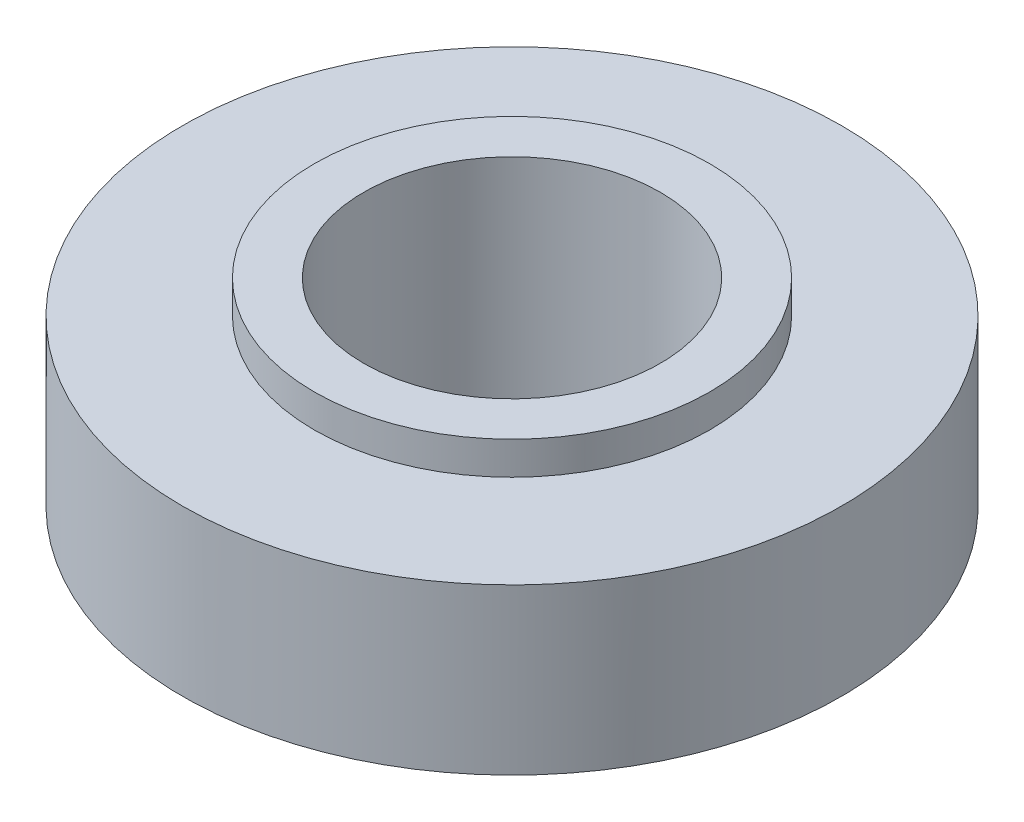
from build123d import *

# Parameters (mm, degrees)
SKETCH1_R           = 10
SKETCH1_R_2         = 4.5
BOSS_EXTRUDE1_DEPTH = 3.5
SKETCH2_R           = 13
SKETCH2_R_2         = 6
CUT_EXTRUDE1_DEPTH  = 1


with BuildPart() as part:
    # Sketch1 → Boss-Extrude1 (new, symmetric)
    with BuildSketch(Plane(origin=(0, 0, 0), x_dir=(1, 0, 0), z_dir=(0, 1, 0))):
        with Locations(Location((0, 0, 0), (0, 0, 270))):
            Circle(SKETCH1_R)
        with Locations(Location((0, 0, 0), (0, 0, 270))):
            Circle(SKETCH1_R_2, mode=Mode.SUBTRACT)
    extrude(amount=BOSS_EXTRUDE1_DEPTH, both=True)

    # Sketch2 → Cut-Extrude1 (cut)
    with BuildSketch(Plane(origin=(0, 3.5, 0), x_dir=(1, 0, 0), z_dir=(0, 1, 0))):
        Circle(SKETCH2_R)
        with Locations(Location((0, 0, 0), (0, 0, 270))):
            Circle(SKETCH2_R_2, mode=Mode.SUBTRACT)
    cut_extrude1 = extrude(amount=-CUT_EXTRUDE1_DEPTH, mode=Mode.SUBTRACT)

    # Mirror1: Cut-Extrude1 across plane
    add(cut_extrude1.mirror(Plane.ZX), mode=Mode.SUBTRACT)


solid = part.part
